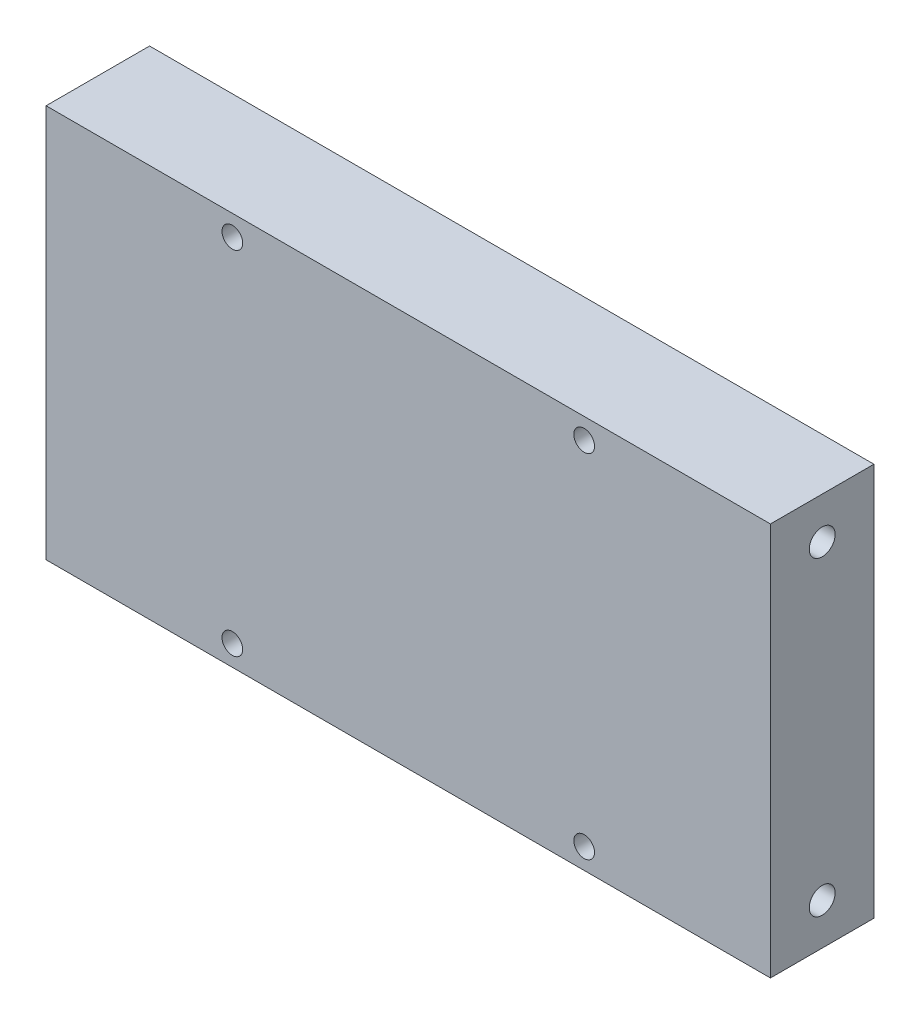
from build123d import *

# Parameters (mm, degrees)
SKETCH1_W           = 70
SKETCH1_H           = 38
SKETCH1_R           = 1
BOSS_EXTRUDE1_DEPTH = 10
SKETCH2_R           = 1.25
CUT_EXTRUDE1_DEPTH  = 12


with BuildPart() as part:
    # Sketch1 → Boss-Extrude1 (new body)
    with BuildSketch(Plane.XY):
        with Locations((-4.613461538, -5.005769231)):
            Rectangle(SKETCH1_W, SKETCH1_H)
        with Locations((-21.613461538, 11.994230769)):
            Circle(SKETCH1_R, mode=Mode.SUBTRACT)
        with Locations((12.386538462, 11.994230769)):
            Circle(SKETCH1_R, mode=Mode.SUBTRACT)
        with Locations((12.386538462, -22.005769231)):
            Circle(SKETCH1_R, mode=Mode.SUBTRACT)
        with Locations((-21.613461538, -22.005769231)):
            Circle(SKETCH1_R, mode=Mode.SUBTRACT)
    extrude(amount=BOSS_EXTRUDE1_DEPTH)

    # Sketch2 → Cut-Extrude1 (cut)
    with BuildSketch(Plane(origin=(30.386538462, 0, 0), x_dir=(0, 0, -1), z_dir=(1, 0, 0))):
        with Locations((-5, 9.994230769)):
            Circle(SKETCH2_R)
        with Locations((-5, -20.005769231)):
            Circle(SKETCH2_R)
    cut_extrude1 = extrude(amount=-CUT_EXTRUDE1_DEPTH, mode=Mode.SUBTRACT)

    # Mirror1: Cut-Extrude1 across plane
    add(cut_extrude1.mirror(Plane.ZY.offset(4.613461538)), mode=Mode.SUBTRACT)


solid = part.part
